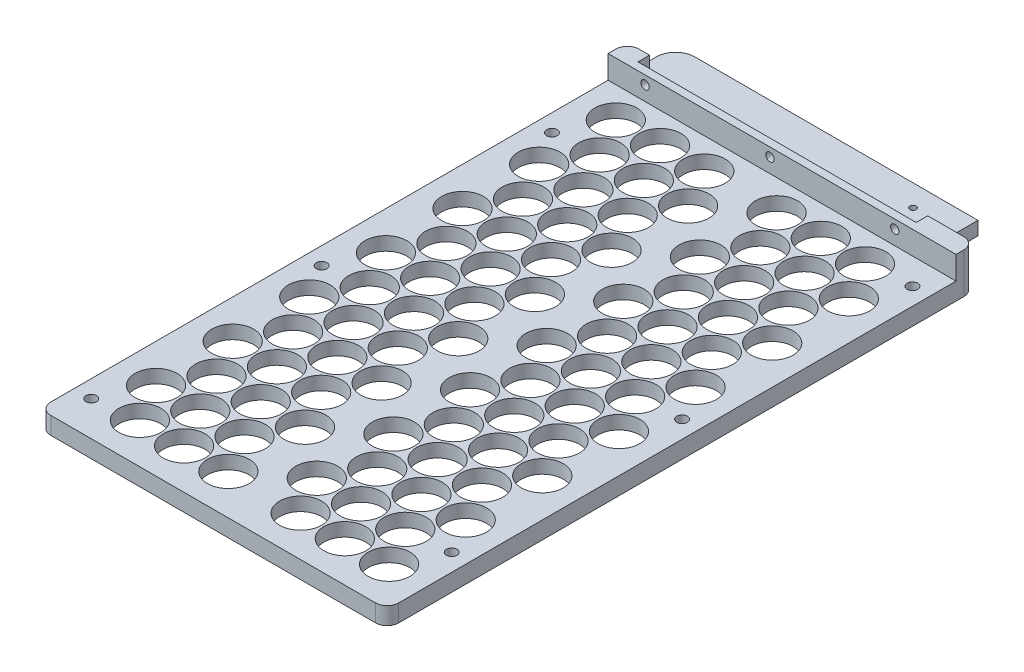
from build123d import *

# Parameters (mm, degrees)
CELL_BLOCK_SKETCH_W                               = 162.5
CELL_BLOCK_SKETCH_H                               = 305.12867922
BOSS_EXTRUDE1_DEPTH                               = 7
SKETCH3_W                                         = 9
SKETCH3_H                                         = 305.12867922
BOSS_EXTRUDE2_DEPTH                               = 7
HOLE_PATTERN_R                                    = 10.875
CUT_EXTRUDE1_DEPTH                                = 7
SKETCH4_R                                         = 2.75
CUT_EXTRUDE2_DEPTH                                = 7
SKETCH5_W                                         = 156.89
SKETCH5_H                                         = 25
BOSS_EXTRUDE3_DEPTH                               = 5
FILLET1_R                                         = 10
SKETCH7_W                                         = 180.5
SKETCH7_H                                         = 10
BOSS_EXTRUDE4_DEPTH                               = 12
SKETCH8_W                                         = 144.315
SKETCH8_H                                         = 54.74
CUT_EXTRUDE3_DEPTH                                = 6
SKETCH9_R                                         = 2.159
CUT_EXTRUDE4_DEPTH                                = 4
SKETCH15_W                                        = 174.5
SKETCH15_H                                        = 289.12867922
BOSS_EXTRUDE5_DEPTH                               = 2
CSK_FOR_4_FLAT_HEAD_SOCKET_CAP_SCREW1_D           = 3.2639
CSK_FOR_4_FLAT_HEAD_SOCKET_CAP_SCREW1_DEPTH       = 9
CSK_FOR_4_FLAT_HEAD_SOCKET_CAP_SCREW1_CSINK_D     = 6.477
CSK_FOR_4_FLAT_HEAD_SOCKET_CAP_SCREW1_CSINK_ANGLE = 82
CSK_FOR_4_FLAT_HEAD_SOCKET_CAP_SCREW1_TIP         = 0.980574487
FILLET6_R                                         = 6


with BuildPart() as part:
    # Cell Block Sketch → Boss-Extrude1 (new body)
    with BuildSketch(Plane(origin=(0, 0, 0), x_dir=(1, 0, 0), z_dir=(0, 1, 0))):
        Rectangle(CELL_BLOCK_SKETCH_W, CELL_BLOCK_SKETCH_H)
    extrude(amount=BOSS_EXTRUDE1_DEPTH)

    # Sketch3 → Boss-Extrude2 (add)
    with BuildSketch(Plane(origin=(0, 0, 0), x_dir=(1, 0, 0), z_dir=(0, 1, 0))):
        with Locations((-85.75, 0)):
            Rectangle(SKETCH3_W, SKETCH3_H)
    boss_extrude2 = extrude(amount=BOSS_EXTRUDE2_DEPTH)

    # Mirror1: Boss-Extrude2 across plane
    add(boss_extrude2.mirror(Plane(origin=(0, 0, 0), x_dir=(0, 0, 1), z_dir=(1, 0, 0))))

    # Hole Pattern → Cut-Extrude1 (cut)
    with BuildSketch(Plane(origin=(0, 7, 0), x_dir=(1, 0, 0), z_dir=(0, 1, 0))):
        with Locations(Location((-70.375, -111.814056593, 0), (0, 0, 270))):
            Circle(HOLE_PATTERN_R)
        with Locations(Location((-58.9, -131.68933961, 0), (0, 0, 270))):
            Circle(HOLE_PATTERN_R)
        with Locations(Location((-70.375, -72.063490559, 0), (0, 0, 270))):
            Circle(HOLE_PATTERN_R)
        with Locations(Location((-58.9, -91.938773576, 0), (0, 0, 270))):
            Circle(HOLE_PATTERN_R)
        with Locations(Location((-70.375, -32.312924525, 0), (0, 0, 270))):
            Circle(HOLE_PATTERN_R)
        with Locations(Location((-58.9, -52.188207542, 0), (0, 0, 270))):
            Circle(HOLE_PATTERN_R)
        with Locations(Location((-70.375, 7.437641508, 0), (0, 0, 270))):
            Circle(HOLE_PATTERN_R)
        with Locations(Location((-58.9, -12.437641508, 0), (0, 0, 270))):
            Circle(HOLE_PATTERN_R)
        with Locations(Location((-70.375, 47.188207542, 0), (0, 0, 270))):
            Circle(HOLE_PATTERN_R)
        with Locations(Location((-58.9, 27.312924525, 0), (0, 0, 270))):
            Circle(HOLE_PATTERN_R)
        with Locations(Location((-70.375, 86.938773576, 0), (0, 0, 270))):
            Circle(HOLE_PATTERN_R)
        with Locations(Location((-58.9, 67.063490559, 0), (0, 0, 270))):
            Circle(HOLE_PATTERN_R)
        with Locations(Location((-70.375, 126.68933961, 0), (0, 0, 270))):
            Circle(HOLE_PATTERN_R)
        with Locations(Location((-58.9, 106.814056593, 0), (0, 0, 270))):
            Circle(HOLE_PATTERN_R)
        with Locations(Location((-47.425, -72.063490559, 0), (0, 0, 270))):
            Circle(HOLE_PATTERN_R)
        with Locations(Location((-35.95, -91.938773576, 0), (0, 0, 270))):
            Circle(HOLE_PATTERN_R)
        with Locations(Location((-47.425, -32.312924525, 0), (0, 0, 270))):
            Circle(HOLE_PATTERN_R)
        with Locations(Location((-35.95, -52.188207542, 0), (0, 0, 270))):
            Circle(HOLE_PATTERN_R)
        with Locations(Location((-47.425, 7.437641508, 0), (0, 0, 270))):
            Circle(HOLE_PATTERN_R)
        with Locations(Location((-35.95, -12.437641508, 0), (0, 0, 270))):
            Circle(HOLE_PATTERN_R)
        with Locations(Location((-47.425, 47.188207542, 0), (0, 0, 270))):
            Circle(HOLE_PATTERN_R)
        with Locations(Location((-35.95, 27.312924525, 0), (0, 0, 270))):
            Circle(HOLE_PATTERN_R)
        with Locations(Location((-47.425, 86.938773576, 0), (0, 0, 270))):
            Circle(HOLE_PATTERN_R)
        with Locations(Location((-35.95, 67.063490559, 0), (0, 0, 270))):
            Circle(HOLE_PATTERN_R)
        with Locations(Location((-47.425, 126.68933961, 0), (0, 0, 270))):
            Circle(HOLE_PATTERN_R)
        with Locations(Location((-35.95, 106.814056593, 0), (0, 0, 270))):
            Circle(HOLE_PATTERN_R)
        with Locations(Location((-24.475, -72.063490559, 0), (0, 0, 270))):
            Circle(HOLE_PATTERN_R)
        with Locations(Location((-13, -91.938773576, 0), (0, 0, 270))):
            Circle(HOLE_PATTERN_R)
        with Locations(Location((-24.475, -32.312924525, 0), (0, 0, 270))):
            Circle(HOLE_PATTERN_R)
        with Locations(Location((-13, -52.188207542, 0), (0, 0, 270))):
            Circle(HOLE_PATTERN_R)
        with Locations(Location((-24.475, 7.437641508, 0), (0, 0, 270))):
            Circle(HOLE_PATTERN_R)
        with Locations(Location((-13, -12.437641508, 0), (0, 0, 270))):
            Circle(HOLE_PATTERN_R)
        with Locations(Location((-24.475, 47.188207542, 0), (0, 0, 270))):
            Circle(HOLE_PATTERN_R)
        with Locations(Location((-13, 27.312924525, 0), (0, 0, 270))):
            Circle(HOLE_PATTERN_R)
        with Locations(Location((-24.475, 86.938773576, 0), (0, 0, 270))):
            Circle(HOLE_PATTERN_R)
        with Locations(Location((-13, 67.063490559, 0), (0, 0, 270))):
            Circle(HOLE_PATTERN_R)
        with Locations(Location((-24.475, 126.68933961, 0), (0, 0, 270))):
            Circle(HOLE_PATTERN_R)
        with Locations(Location((-13, 106.814056593, 0), (0, 0, 270))):
            Circle(HOLE_PATTERN_R)
        with Locations(Location((-47.425, -111.814056593, 0), (0, 0, 270))):
            Circle(HOLE_PATTERN_R)
        with Locations(Location((-35.95, -131.68933961, 0), (0, 0, 270))):
            Circle(HOLE_PATTERN_R)
        with Locations(Location((-24.475, -111.814056593, 0), (0, 0, 270))):
            Circle(HOLE_PATTERN_R)
        with Locations(Location((-13, -131.68933961, 0), (0, 0, 270))):
            Circle(HOLE_PATTERN_R)
        with Locations(Location((70.375, -131.68933961, 0), (0, 0, 270))):
            Circle(HOLE_PATTERN_R)
        with Locations(Location((58.9, -111.814056593, 0), (0, 0, 270))):
            Circle(HOLE_PATTERN_R)
        with Locations(Location((35.95, -111.814056593, 0), (0, 0, 270))):
            Circle(HOLE_PATTERN_R)
        with Locations(Location((47.425, -131.68933961, 0), (0, 0, 270))):
            Circle(HOLE_PATTERN_R)
        with Locations(Location((13, -111.814056593, 0), (0, 0, 270))):
            Circle(HOLE_PATTERN_R)
        with Locations(Location((24.475, -131.68933961, 0), (0, 0, 270))):
            Circle(HOLE_PATTERN_R)
        with Locations(Location((35.95, -72.063490559, 0), (0, 0, 270))):
            Circle(HOLE_PATTERN_R)
        with Locations(Location((47.425, -91.938773576, 0), (0, 0, 270))):
            Circle(HOLE_PATTERN_R)
        with Locations(Location((13, -72.063490559, 0), (0, 0, 270))):
            Circle(HOLE_PATTERN_R)
        with Locations(Location((24.475, -91.938773576, 0), (0, 0, 270))):
            Circle(HOLE_PATTERN_R)
        with Locations(Location((35.95, -32.312924525, 0), (0, 0, 270))):
            Circle(HOLE_PATTERN_R)
        with Locations(Location((47.425, -52.188207542, 0), (0, 0, 270))):
            Circle(HOLE_PATTERN_R)
        with Locations(Location((13, -32.312924525, 0), (0, 0, 270))):
            Circle(HOLE_PATTERN_R)
        with Locations(Location((24.475, -52.188207542, 0), (0, 0, 270))):
            Circle(HOLE_PATTERN_R)
        with Locations(Location((35.95, 7.437641508, 0), (0, 0, 270))):
            Circle(HOLE_PATTERN_R)
        with Locations(Location((47.425, -12.437641508, 0), (0, 0, 270))):
            Circle(HOLE_PATTERN_R)
        with Locations(Location((13, 7.437641508, 0), (0, 0, 270))):
            Circle(HOLE_PATTERN_R)
        with Locations(Location((24.475, -12.437641508, 0), (0, 0, 270))):
            Circle(HOLE_PATTERN_R)
        with Locations(Location((35.95, 47.188207542, 0), (0, 0, 270))):
            Circle(HOLE_PATTERN_R)
        with Locations(Location((47.425, 27.312924525, 0), (0, 0, 270))):
            Circle(HOLE_PATTERN_R)
        with Locations(Location((13, 47.188207542, 0), (0, 0, 270))):
            Circle(HOLE_PATTERN_R)
        with Locations(Location((24.475, 27.312924525, 0), (0, 0, 270))):
            Circle(HOLE_PATTERN_R)
        with Locations(Location((35.95, 86.938773576, 0), (0, 0, 270))):
            Circle(HOLE_PATTERN_R)
        with Locations(Location((47.425, 67.063490559, 0), (0, 0, 270))):
            Circle(HOLE_PATTERN_R)
        with Locations(Location((13, 86.938773576, 0), (0, 0, 270))):
            Circle(HOLE_PATTERN_R)
        with Locations(Location((24.475, 67.063490559, 0), (0, 0, 270))):
            Circle(HOLE_PATTERN_R)
        with Locations(Location((35.95, 126.68933961, 0), (0, 0, 270))):
            Circle(HOLE_PATTERN_R)
        with Locations(Location((47.425, 106.814056593, 0), (0, 0, 270))):
            Circle(HOLE_PATTERN_R)
        with Locations(Location((13, 126.68933961, 0), (0, 0, 270))):
            Circle(HOLE_PATTERN_R)
        with Locations(Location((24.475, 106.814056593, 0), (0, 0, 270))):
            Circle(HOLE_PATTERN_R)
        with Locations(Location((58.9, -72.063490559, 0), (0, 0, 270))):
            Circle(HOLE_PATTERN_R)
        with Locations(Location((70.375, -91.938773576, 0), (0, 0, 270))):
            Circle(HOLE_PATTERN_R)
        with Locations(Location((58.9, -32.312924525, 0), (0, 0, 270))):
            Circle(HOLE_PATTERN_R)
        with Locations(Location((70.375, -52.188207542, 0), (0, 0, 270))):
            Circle(HOLE_PATTERN_R)
        with Locations(Location((58.9, 7.437641508, 0), (0, 0, 270))):
            Circle(HOLE_PATTERN_R)
        with Locations(Location((70.375, -12.437641508, 0), (0, 0, 270))):
            Circle(HOLE_PATTERN_R)
        with Locations(Location((58.9, 47.188207542, 0), (0, 0, 270))):
            Circle(HOLE_PATTERN_R)
        with Locations(Location((70.375, 27.312924525, 0), (0, 0, 270))):
            Circle(HOLE_PATTERN_R)
        with Locations(Location((58.9, 86.938773576, 0), (0, 0, 270))):
            Circle(HOLE_PATTERN_R)
        with Locations(Location((70.375, 67.063490559, 0), (0, 0, 270))):
            Circle(HOLE_PATTERN_R)
        with Locations(Location((58.9, 126.68933961, 0), (0, 0, 270))):
            Circle(HOLE_PATTERN_R)
        with Locations(Location((70.375, 106.814056593, 0), (0, 0, 270))):
            Circle(HOLE_PATTERN_R)
    extrude(amount=-CUT_EXTRUDE1_DEPTH, mode=Mode.SUBTRACT)

    # Sketch4 → Cut-Extrude2 (cut)
    with BuildSketch(Plane(origin=(0, 7, 0), x_dir=(1, 0, 0), z_dir=(0, 1, 0))):
        with Locations(Location((-81.25, 104.43566039, 0), (0, 0, 270))):
            Circle(SKETCH4_R)
        with Locations(Location((-81.25, -15.06433961, 0), (0, 0, 270))):
            Circle(SKETCH4_R)
        with Locations(Location((-81.25, -134.56433961, 0), (0, 0, 270))):
            Circle(SKETCH4_R)
        with Locations(Location((81.25, -110.06433961, 0), (0, 0, 270))):
            Circle(SKETCH4_R)
        with Locations(Location((81.25, 9.43566039, 0), (0, 0, 270))):
            Circle(SKETCH4_R)
        with Locations(Location((81.25, 128.93566039, 0), (0, 0, 270))):
            Circle(SKETCH4_R)
    extrude(amount=-CUT_EXTRUDE2_DEPTH, mode=Mode.SUBTRACT)

    # Sketch5 → Boss-Extrude3 (add)
    with BuildSketch(Plane(origin=(0, 0, 0), x_dir=(1, 0, 0), z_dir=(0, 1, 0))):
        with Locations((-11.805, 165.06433961)):
            Rectangle(SKETCH5_W, SKETCH5_H)
    extrude(amount=BOSS_EXTRUDE3_DEPTH)

    # Fillet1
    fillet1_edges = [part.edges().sort_by_distance(p)[0] for p in [
        (-90.25, 2.5, -177.56433961),
    ]]
    fillet(fillet1_edges, radius=FILLET1_R)

    # Sketch7 → Boss-Extrude4 (add)
    with BuildSketch(Plane(origin=(0, 7, 0), x_dir=(1, 0, 0), z_dir=(0, 1, 0))):
        with Locations((0, 147.56433961)):
            Rectangle(SKETCH7_W, SKETCH7_H)
    extrude(amount=BOSS_EXTRUDE4_DEPTH)

    # Sketch8 → Cut-Extrude3 (cut)
    with BuildSketch(Plane(origin=(0, 0, -152.56433961), x_dir=(-1, 0, 0), z_dir=(0, 0, -1))):
        with Locations((6.5925, 35.78)):
            Rectangle(SKETCH8_W, SKETCH8_H)
    extrude(amount=-CUT_EXTRUDE3_DEPTH, mode=Mode.SUBTRACT)

    # Sketch9 → Cut-Extrude4 (cut)
    with BuildSketch(Plane(origin=(0, 0, -146.56433961), x_dir=(-1, 0, 0), z_dir=(0, 0, -1))):
        with Locations((-58.485, 14.49)):
            Circle(SKETCH9_R)
        with Locations((6.285, 14.49)):
            Circle(SKETCH9_R)
        with Locations((71.055, 14.49)):
            Circle(SKETCH9_R)
    extrude(amount=-CUT_EXTRUDE4_DEPTH, mode=Mode.SUBTRACT)

    # Sketch15 → Boss-Extrude5 (add)
    with BuildSketch(Plane.XZ):
        with BuildLine():
            Line((90.25, -152.56433961), (90.25, 152.56433961))
            Line((90.25, 152.56433961), (-90.25, 152.56433961))
            Line((-90.25, 152.56433961), (-90.25, -167.56433961))
            ThreePointArc((-90.25, -167.56433961), (-87.321067812, -174.635407421), (-80.25, -177.56433961))
            Line((-80.25, -177.56433961), (66.64, -177.56433961))
            Line((66.64, -177.56433961), (66.64, -152.56433961))
            Line((66.64, -152.56433961), (90.25, -152.56433961))
        make_face()
        with Locations((0, 2)):
            Rectangle(SKETCH15_W, SKETCH15_H, mode=Mode.SUBTRACT)
    extrude(amount=BOSS_EXTRUDE5_DEPTH)

    # CSK for #4 Flat Head Socket Cap Screw1
    with Locations(Plane.XZ.offset(2)):
        with Locations((44.14, -166.31433961)):
            CounterSinkHole(CSK_FOR_4_FLAT_HEAD_SOCKET_CAP_SCREW1_D / 2, CSK_FOR_4_FLAT_HEAD_SOCKET_CAP_SCREW1_CSINK_D / 2, depth=CSK_FOR_4_FLAT_HEAD_SOCKET_CAP_SCREW1_DEPTH, counter_sink_angle=CSK_FOR_4_FLAT_HEAD_SOCKET_CAP_SCREW1_CSINK_ANGLE)
            with Locations((0, 0, -(CSK_FOR_4_FLAT_HEAD_SOCKET_CAP_SCREW1_DEPTH + CSK_FOR_4_FLAT_HEAD_SOCKET_CAP_SCREW1_TIP / 2))):  # 118° drill point
                Cone(0, CSK_FOR_4_FLAT_HEAD_SOCKET_CAP_SCREW1_D / 2, CSK_FOR_4_FLAT_HEAD_SOCKET_CAP_SCREW1_TIP, mode=Mode.SUBTRACT)

    # Fillet6
    fillet6_edges = [part.edges().sort_by_distance(p)[0] for p in [
        (-90.25, 12, -152.56433961),
        (-90.25, 2.5, 152.56433961),
        (90.25, 2.5, 152.56433961),
        (90.25, 8.5, -152.56433961),
    ]]
    fillet(fillet6_edges, radius=FILLET6_R)


solid = part.part
